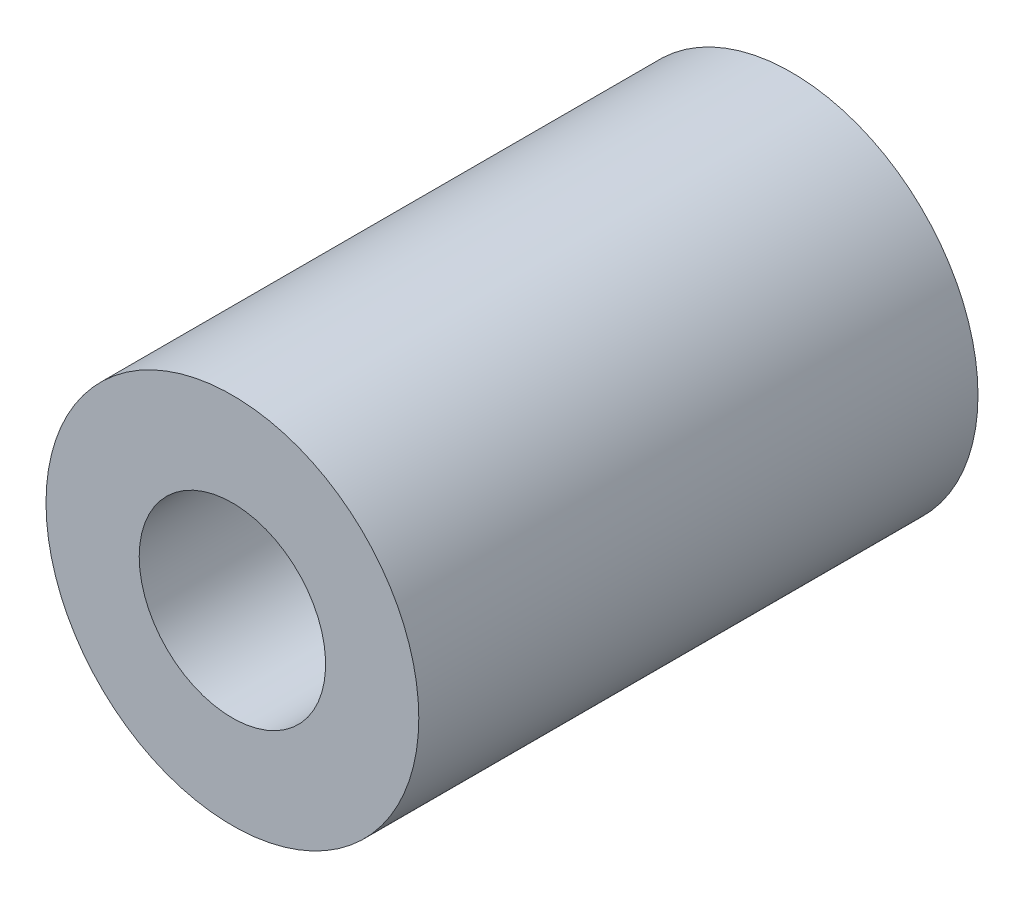
from build123d import *

# Parameters (mm, degrees)
SKETCH1_R           = 6.35
SKETCH1_R_2         = 3.175
BOSS_EXTRUDE1_DEPTH = 9.525


with BuildPart() as part:
    # Sketch1 → Boss-Extrude1 (new, symmetric)
    with BuildSketch(Plane.XY):
        with Locations(Location((0, 0, 0), (0, 0, 180))):
            Circle(SKETCH1_R)
        with Locations(Location((0, 0, 0), (0, 0, 180))):
            Circle(SKETCH1_R_2, mode=Mode.SUBTRACT)
    extrude(amount=BOSS_EXTRUDE1_DEPTH, both=True)


solid = part.part
